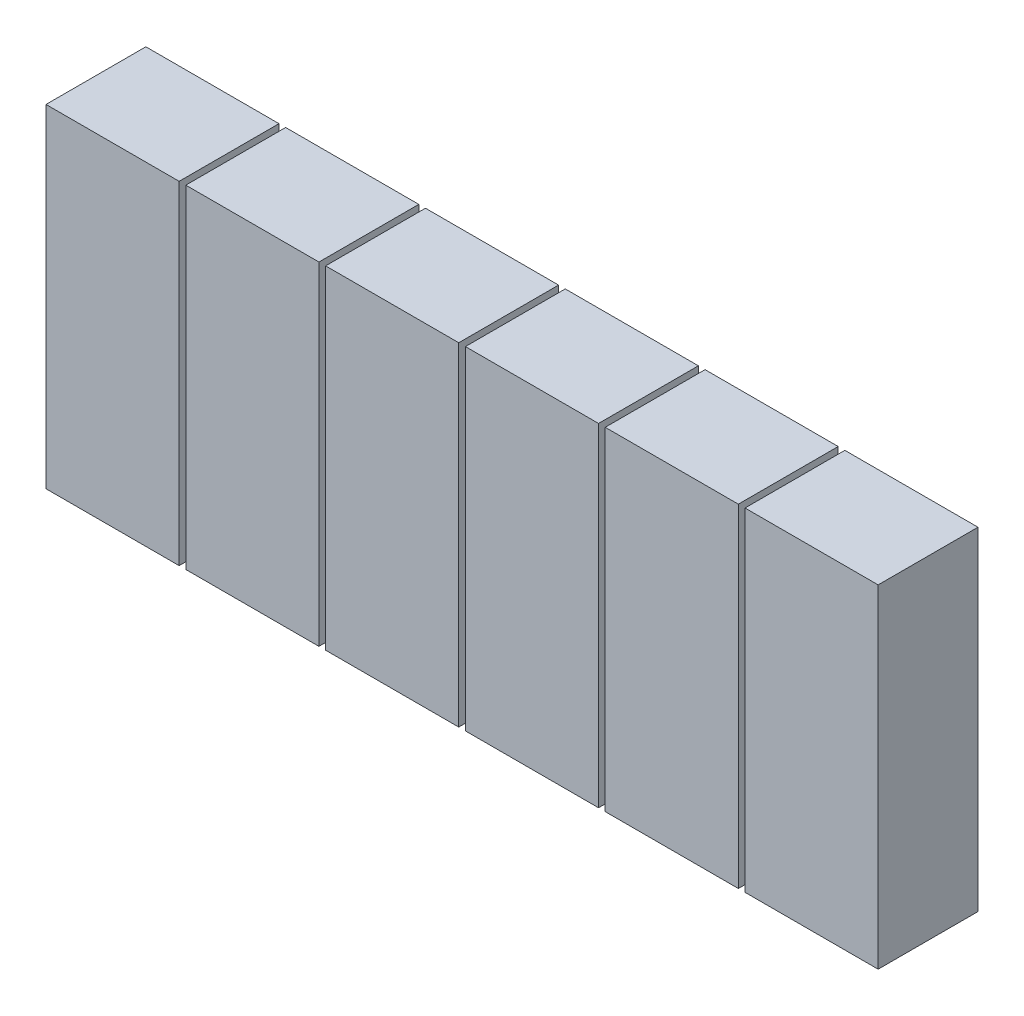
from build123d import *

# Parameters (mm, degrees)
SKETCH2_W             = 2000
SKETCH2_H             = 5000
BOSS_EXTRUDE1_DEPTH   = 1500
BOSS_EXTRUDE1_2_DEPTH = 1500
BOSS_EXTRUDE1_3_DEPTH = 1500
BOSS_EXTRUDE1_4_DEPTH = 1500
BOSS_EXTRUDE1_5_DEPTH = 1500
BOSS_EXTRUDE1_6_DEPTH = 1500


with BuildPart() as part:
    # Sketch2 → Boss-Extrude1 (new body)
    with BuildSketch(Plane.XY):
        with Locations((2100, 0)):
            Rectangle(SKETCH2_W, SKETCH2_H)
    extrude(amount=BOSS_EXTRUDE1_DEPTH)


with BuildPart() as body_2:
    # Sketch2 → Boss-Extrude1 2 (new body)
    with BuildSketch(Plane.XY):
        Rectangle(SKETCH2_W, SKETCH2_H)
    extrude(amount=BOSS_EXTRUDE1_2_DEPTH)


with BuildPart() as body_3:
    # Sketch2 → Boss-Extrude1 3 (new body)
    with BuildSketch(Plane.XY):
        with Locations((4200, 0)):
            Rectangle(SKETCH2_W, SKETCH2_H)
    extrude(amount=BOSS_EXTRUDE1_3_DEPTH)


with BuildPart() as body_4:
    # Sketch2 → Boss-Extrude1 4 (new body)
    with BuildSketch(Plane.XY):
        with Locations((6300, 0)):
            Rectangle(SKETCH2_W, SKETCH2_H)
    extrude(amount=BOSS_EXTRUDE1_4_DEPTH)


with BuildPart() as body_5:
    # Sketch2 → Boss-Extrude1 5 (new body)
    with BuildSketch(Plane.XY):
        with Locations((8400, 0)):
            Rectangle(SKETCH2_W, SKETCH2_H)
    extrude(amount=BOSS_EXTRUDE1_5_DEPTH)


with BuildPart() as body_6:
    # Sketch2 → Boss-Extrude1 6 (new body)
    with BuildSketch(Plane.XY):
        with Locations((10500, 0)):
            Rectangle(SKETCH2_W, SKETCH2_H)
    extrude(amount=BOSS_EXTRUDE1_6_DEPTH)


solid = Compound([part.part, body_2.part, body_3.part, body_4.part, body_5.part, body_6.part])
